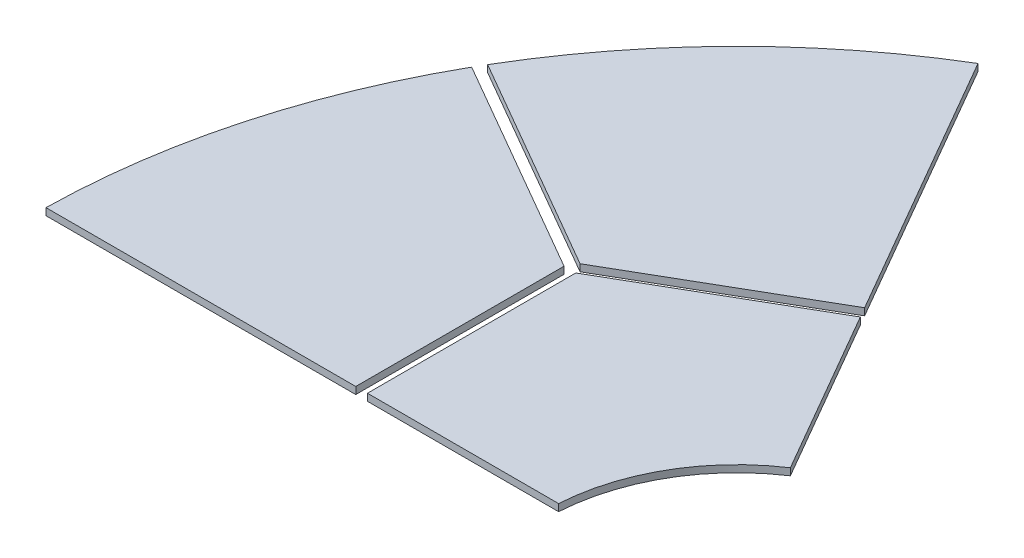
from build123d import *

# Parameters (mm, degrees)
BOSS_EXTRUDE1_DEPTH   = 6
BOSS_EXTRUDE1_2_DEPTH = 6
BOSS_EXTRUDE1_3_DEPTH = 6


with BuildPart() as part:
    # Sketch1 → Boss-Extrude1 (new body)
    with BuildSketch(Plane(origin=(0, 0, 0), x_dir=(1, 0, 0), z_dir=(0, 1, 0))):
        with BuildLine():
            ThreePointArc((-599.516605275, 10), (-578.516992176, 157.601553812), (-521.750777563, 295.459449184))
            Line((-521.750777563, 295.459449184), (-335.2, 187.75430754))
            Line((-335.2, 187.75430754), (-335.2, 10))
            Line((-335.2, 10), (-599.516605275, 10))
        make_face()
    extrude(amount=BOSS_EXTRUDE1_DEPTH)


with BuildPart() as body_2:
    # Sketch1 → Boss-Extrude1 2 (new body)
    with BuildSketch(Plane(origin=(0, 0, 0), x_dir=(1, 0, 0), z_dir=(0, 1, 0))):
        with BuildLine():
            ThreePointArc((-516.750777563, 304.119703222), (-425.745445365, 422.209634839), (-308.418556675, 514.196610158))
            Line((-308.418556675, 514.196610158), (-176.260254038, 285.291715349))
            Line((-176.260254038, 285.291715349), (-330.2, 196.414561578))
            Line((-330.2, 196.414561578), (-516.750777563, 304.119703222))
        make_face()
    extrude(amount=BOSS_EXTRUDE1_2_DEPTH)


with BuildPart() as body_3:
    # Sketch1 → Boss-Extrude1 3 (new body)
    with BuildSketch(Plane(origin=(0, 0, 0), x_dir=(1, 0, 0), z_dir=(0, 1, 0))):
        with BuildLine():
            ThreePointArc((-89.706166951, 135.375638912), (-140.642525575, 81.2), (-162.091825827, 10))
            Line((-162.091825827, 10), (-325.2, 10))
            Line((-325.2, 10), (-325.2, 187.75430754))
            Line((-325.2, 187.75430754), (-171.260254038, 276.631461311))
            Line((-171.260254038, 276.631461311), (-89.706166951, 135.375638912))
        make_face()
    extrude(amount=BOSS_EXTRUDE1_3_DEPTH)


solid = Compound([part.part, body_2.part, body_3.part])
